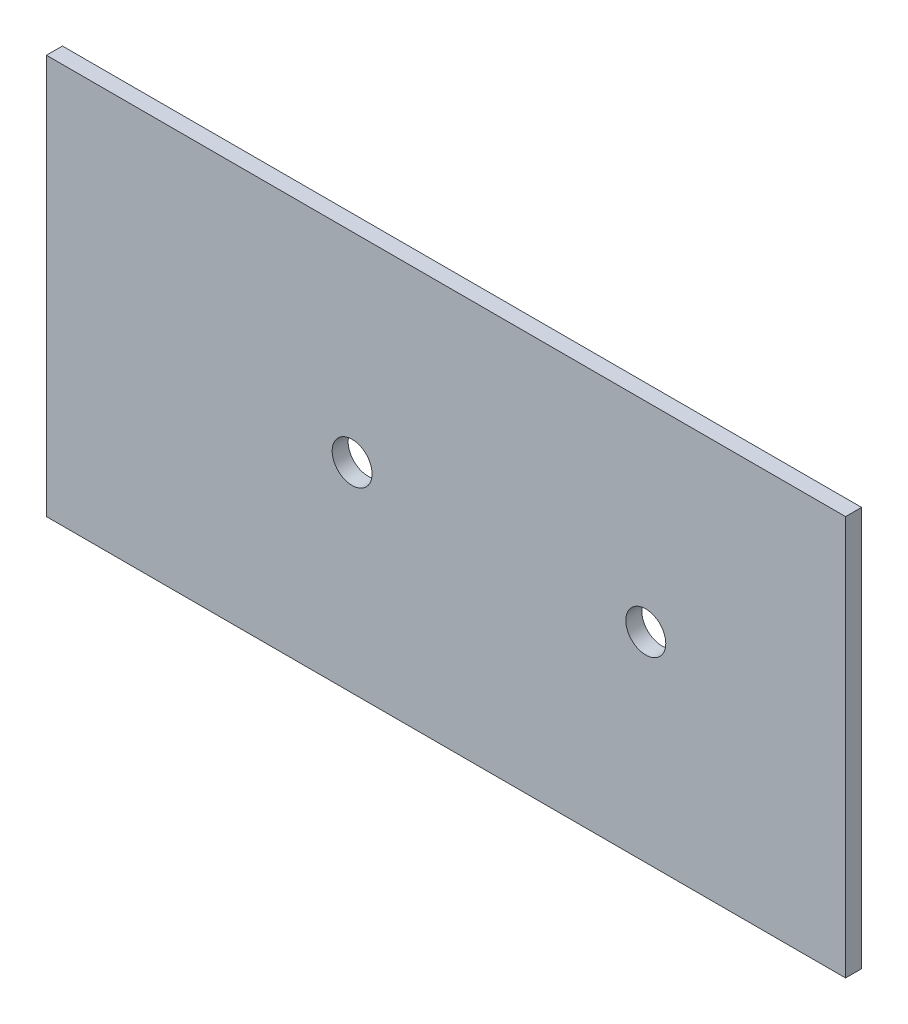
from build123d import *

# Parameters (mm, degrees)
SKETCH1_W           = 200
SKETCH1_H           = 100
SKETCH1_R           = 5
BOSS_EXTRUDE1_DEPTH = 4


with BuildPart() as part:
    # Sketch1 → Boss-Extrude1 (new body)
    with BuildSketch(Plane.XY):
        with Locations((-50, 0)):
            Rectangle(SKETCH1_W, SKETCH1_H)
        Circle(SKETCH1_R, mode=Mode.SUBTRACT)
        with Locations((-73.5, 0)):
            Circle(SKETCH1_R, mode=Mode.SUBTRACT)
    extrude(amount=BOSS_EXTRUDE1_DEPTH)


solid = part.part
